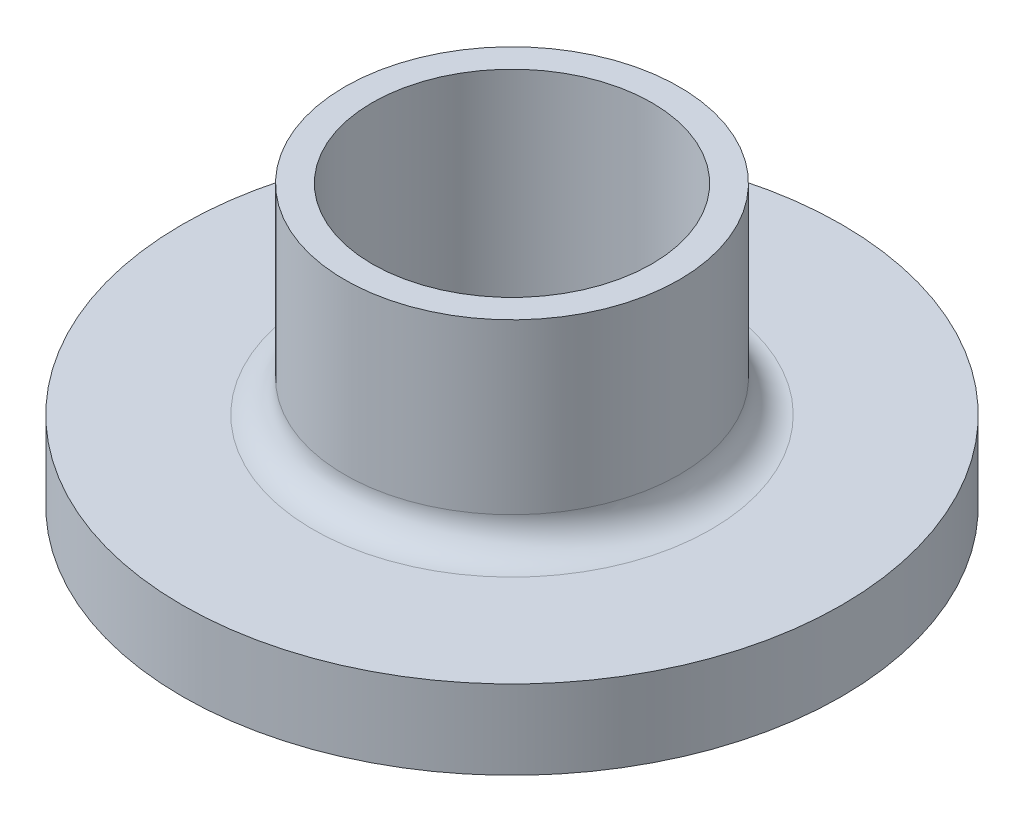
from build123d import *

# Parameters (mm, degrees)
FILLET1_R = 0.762


with BuildPart() as part:
    # Sketch1 → Revolve1 (revolve)
    with BuildSketch(Plane.XY, mode=Mode.PRIVATE) as revolve1_sk:
        Polygon((3.3655, 0), (7.9375, 0), (7.9375, 1.905), (4.0259, 1.905), (4.0259, 6.731), (3.3655, 6.731), align=None)
    revolve(revolve1_sk.sketch.rotate(Axis((0, 17.130002105, 0), (0, -1, 0)), 180), axis=Axis((0, 17.130002105, 0), (0, -1, 0)))

    # Fillet1
    fillet1_edges = [part.edges().sort_by_distance(p)[0] for p in [
        (4.0259, 1.905, 0),
    ]]
    fillet(fillet1_edges, radius=FILLET1_R)


solid = part.part
